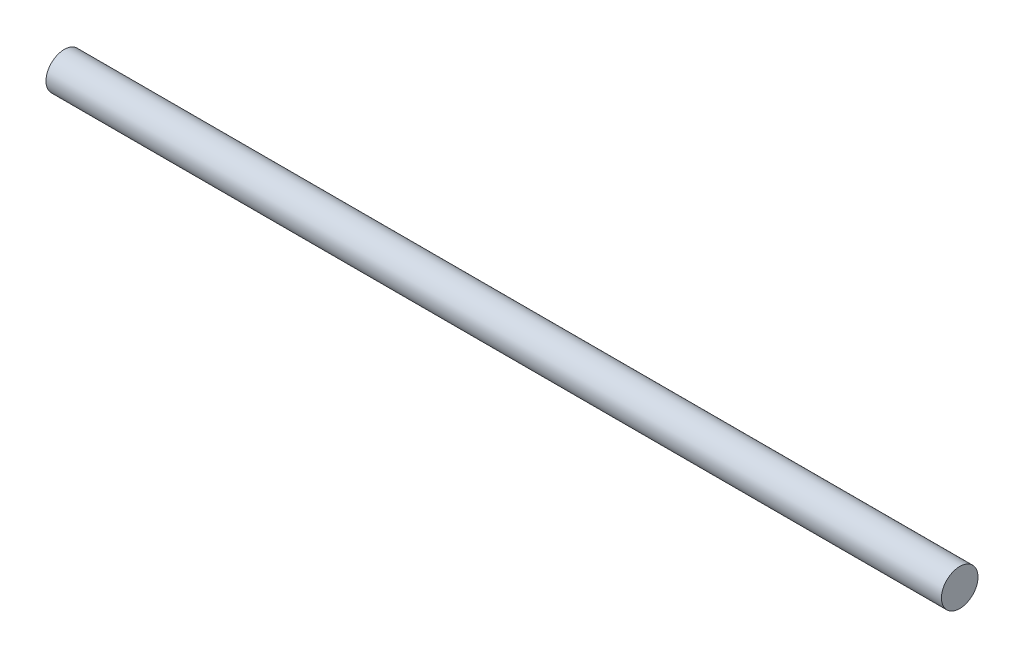
from build123d import *

# Parameters (mm, degrees)
SKETCH1_R           = 9
BOSS_EXTRUDE1_DEPTH = 220.5


with BuildPart() as part:
    # Sketch1 → Boss-Extrude1 (new, symmetric)
    with BuildSketch(Plane(origin=(0, 0, 0), x_dir=(0, 0, -1), z_dir=(1, 0, 0))):
        Circle(SKETCH1_R)
    extrude(amount=BOSS_EXTRUDE1_DEPTH, both=True)


solid = part.part
